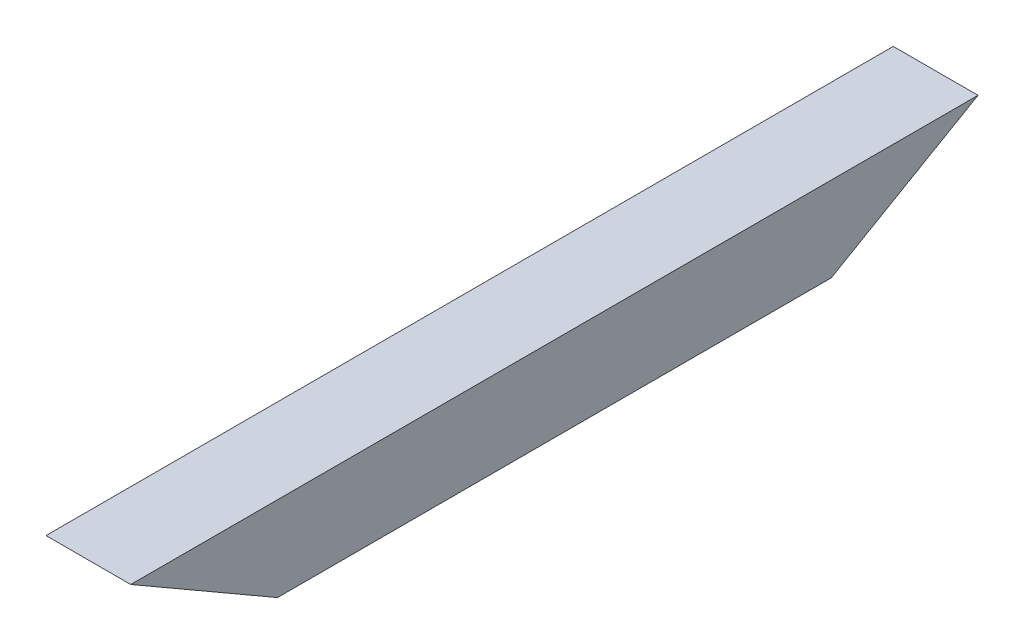
from build123d import *

# Parameters (mm, degrees)
SKETCH1_W           = 50.8
SKETCH1_H           = 50.8
SKETCH1_W_2         = 44.45
SKETCH1_H_2         = 44.45
BOSS_EXTRUDE1_DEPTH = 508
CUT_EXTRUDE1_DEPTH  = 512.165139656


with BuildPart() as part:
    # Sketch1 → Boss-Extrude1 (new body)
    with BuildSketch(Plane.XY):
        Rectangle(SKETCH1_W, SKETCH1_H)
        Rectangle(SKETCH1_W_2, SKETCH1_H_2, mode=Mode.SUBTRACT)
    extrude(amount=BOSS_EXTRUDE1_DEPTH)

    # Sketch2 → Cut-Extrude1 (cut, through all)
    with BuildSketch(Plane.ZY.offset(25.4)):
        Polygon((0, 25.4), (87.988181024, -25.4), (0, -25.4), align=None)
        Polygon((508, 25.4), (420.011818975, -25.4), (508, -25.4), align=None)
    extrude(amount=-CUT_EXTRUDE1_DEPTH, mode=Mode.SUBTRACT)


solid = part.part
